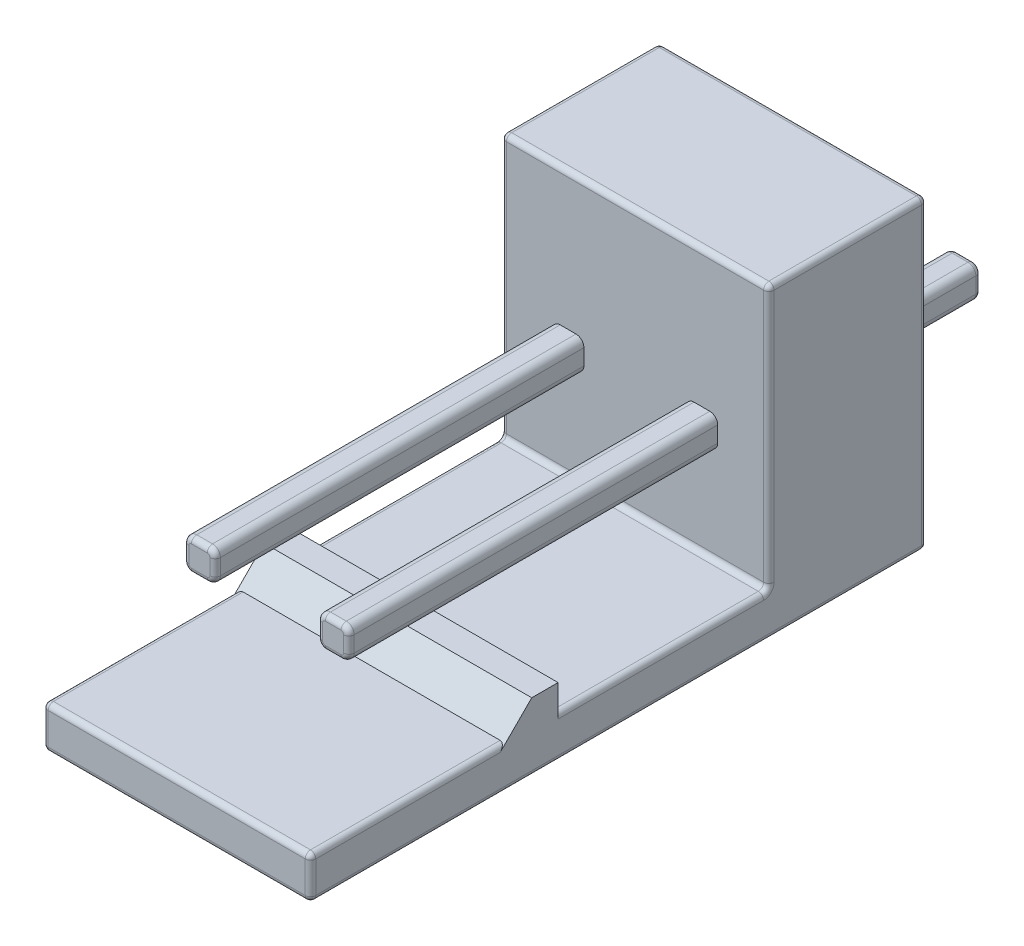
from build123d import *

# Parameters (mm, degrees)
SKETCH_1_W             = 5.08
SKETCH_1_H             = 5.8
EXTRUDE_1_DEPTH        = 11.7
CUT_EXTRUDE_1_DEPTH    = 14.080764504
EXTRUDE_START          = -10
EXTRUDE_2_DEPTH        = 12
FILLET_1_R             = 0.1
FILLET_2_R             = 0.1
FILLET_1_OF_MIRROR_2_R = 0.1


with BuildPart() as part:
    # 草图1 → 凸台-拉伸1 (new body)
    with BuildSketch(Plane.XY):
        Rectangle(SKETCH_1_W, SKETCH_1_H)
    extrude(amount=EXTRUDE_1_DEPTH)

    # 草图2 → 切除-拉伸1 (cut, through all)
    with BuildSketch(Plane(origin=(2.54, 0, 0), x_dir=(0, 0, -1), z_dir=(1, 0, 0))):
        Polygon((-11.7, -2.1), (-8, -2.1), (-7.5, -1.6), (-7, -1.6), (-7, -2.1), (-3, -2.1), (-3, 2.9), (-11.7, 2.9), align=None)
    extrude(amount=-CUT_EXTRUDE_1_DEPTH, mode=Mode.SUBTRACT)

    # 草图3 → 凸台-拉伸2 (add)
    with BuildSketch(Plane(origin=(0, 0, 0), x_dir=(-1, 0, 0), z_dir=(0, 0, -1)).offset(EXTRUDE_START)):
        with BuildLine():
            Line((-1.57, -0.15), (-1.57, 0.15))
            ThreePointArc((-1.57, 0.15), (-1.526066017, 0.256066017), (-1.42, 0.3))
            Line((-1.42, 0.3), (-1.12, 0.3))
            ThreePointArc((-1.12, 0.3), (-1.013933983, 0.256066017), (-0.97, 0.15))
            Line((-0.97, 0.15), (-0.97, -0.15))
            ThreePointArc((-0.97, -0.15), (-1.013933983, -0.256066017), (-1.12, -0.3))
            Line((-1.12, -0.3), (-1.42, -0.3))
            ThreePointArc((-1.42, -0.3), (-1.526066017, -0.256066017), (-1.57, -0.15))
        make_face()
    extrude_2 = extrude(amount=EXTRUDE_2_DEPTH)

    # 圆角1
    fillet_1_edges = [part.edges().sort_by_distance(p)[0] for p in [
        (1.013933983, 0.256066017, 10),
        (0.97, 0, 10),
        (1.013933983, -0.256066017, 10),
        (1.27, -0.3, 10),
        (1.526066017, -0.256066017, 10),
        (1.57, 0, 10),
        (1.526066017, 0.256066017, 10),
        (1.27, 0.3, 10),
        (1.013933983, 0.256066017, -2),
        (1.27, 0.3, -2),
        (1.526066017, 0.256066017, -2),
        (1.57, 0, -2),
        (1.526066017, -0.256066017, -2),
        (1.27, -0.3, -2),
        (1.013933983, -0.256066017, -2),
        (0.97, 0, -2),
    ]]
    fillet(fillet_1_edges, radius=FILLET_1_R)

    # 圆角2
    fillet_2_edges = [part.edges().sort_by_distance(p)[0] for p in [
        (0, -2.9, 11.7),
        (-2.54, -2.5, 11.7),
        (-2.54, 2.9, 1.5),
        (2.54, 2.9, 1.5),
        (0, -2.1, 11.7),
        (-2.54, 0.4, 3),
        (0, 2.9, 3),
        (-2.54, -2.1, 5),
        (0, -2.1, 3),
        (-2.54, -2.1, 9.85),
        (2.54, -2.1, 9.85),
        (2.54, -2.1, 5),
        (2.54, 0.4, 3),
        (2.54, -2.5, 11.7),
        (0, -2.9, 0),
        (-2.54, 0, 0),
        (0, 2.9, 0),
        (2.54, 0, 0),
        (2.54, -2.9, 5.85),
        (-2.54, -2.9, 5.85),
    ]]
    fillet(fillet_2_edges, radius=FILLET_2_R)

    # 镜向2: 凸台-拉伸2 across plane
    add(extrude_2.mirror(Plane(origin=(0, 0, 0), x_dir=(0, 0, 1), z_dir=(1, 0, 0))))

    # 圆角1 of 镜向2
    fillet_1_of_mirror_2_edges = [part.edges().sort_by_distance(p)[0] for p in [
        (-1.013933983, 0.256066017, 10),
        (-0.97, 0, 10),
        (-1.013933983, -0.256066017, 10),
        (-1.27, -0.3, 10),
        (-1.526066017, -0.256066017, 10),
        (-1.57, 0, 10),
        (-1.526066017, 0.256066017, 10),
        (-1.27, 0.3, 10),
        (-1.013933983, 0.256066017, -2),
        (-1.27, 0.3, -2),
        (-1.526066017, 0.256066017, -2),
        (-1.57, 0, -2),
        (-1.526066017, -0.256066017, -2),
        (-1.27, -0.3, -2),
        (-1.013933983, -0.256066017, -2),
        (-0.97, 0, -2),
    ]]
    fillet(fillet_1_of_mirror_2_edges, radius=FILLET_1_OF_MIRROR_2_R)


solid = part.part
